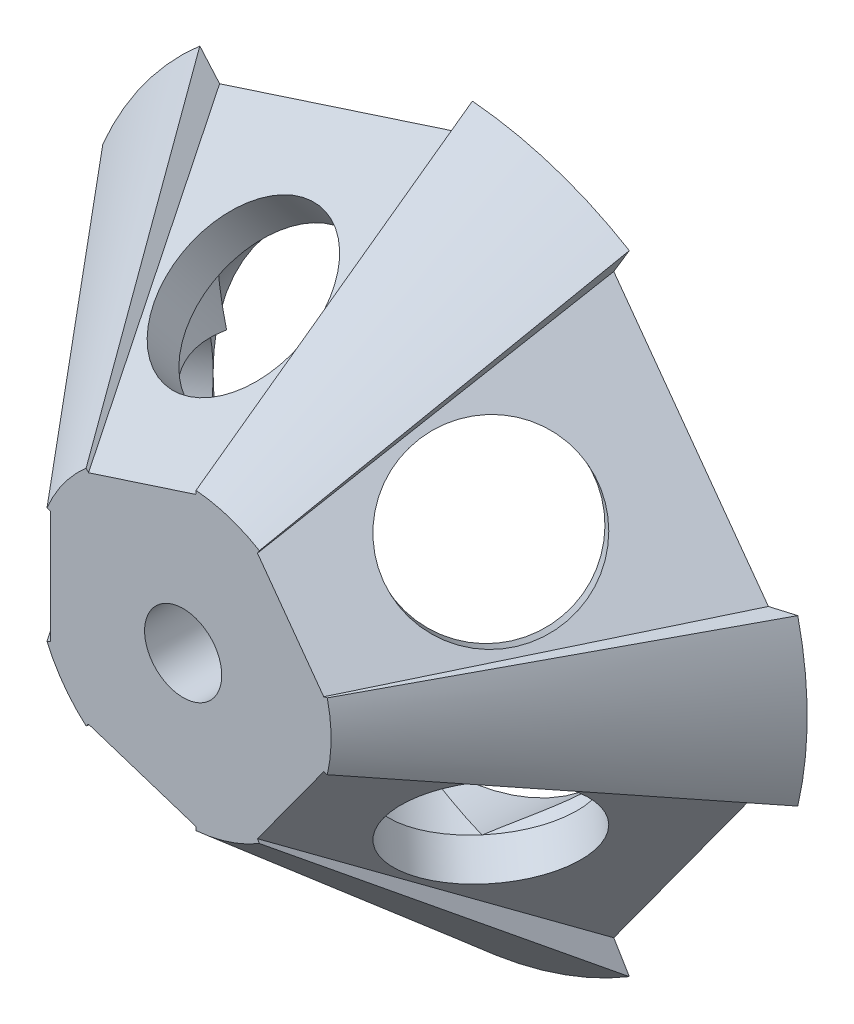
from build123d import *

# Parameters (mm, degrees)
SKETCH4_R          = 6.5
CUT_EXTRUDE1_DEPTH = 30
SKETCH5_R          = 5
CUT_EXTRUDE2_DEPTH = 12
SKETCH10_R         = 17.67367617
CUT_EXTRUDE4_DEPTH = 5
CIRPATTERN1_COUNT  = 5
CIRPATTERN2_COUNT  = 5
SKETCH7_R          = 3
CUT_EXTRUDE3_DEPTH = 20
REVOLVE1_ANGLE     = 26
CIRPATTERN3_COUNT  = 5


with BuildPart() as part:
    # Sketch2 → Loft1 section 0
    with BuildSketch(Plane.XY):
        with BuildLine():
            Line((9.200294462, -28.315594803), (29.772778292, 0))
            Line((29.772778292, 0), (9.200294462, 28.315594803))
            Line((9.200294462, 28.315594803), (-24.086683608, 17.5))
            Line((-24.086683608, 17.5), (-24.086683608, -17.5))
            Line((-24.086683608, -17.5), (9.200294462, -28.315594803))
        make_face()
    # Sketch3 → Loft1 section 1
    with BuildSketch(Plane.XY.offset(20)):
        with BuildLine():
            Line((-10.322864404, 7.5), (-10.322864404, -7.5))
            Line((-10.322864404, -7.5), (3.942983341, -12.135254916))
            Line((3.942983341, -12.135254916), (12.759762125, 0))
            Line((12.759762125, 0), (3.942983341, 12.135254916))
            Line((3.942983341, 12.135254916), (-10.322864404, 7.5))
        make_face()
    loft()

    # Sketch4 → Cut-Extrude1 (cut)
    with BuildSketch(Plane(origin=(-16.345393931, 0, 11.248752345), x_dir=(0.5669152706817989, 0, 0.8237761078519957), z_dir=(-0.8237761078519957, 0, 0.5669152706817989))):
        with Locations((-1.515888034, 0)):
            Circle(SKETCH4_R)
    cut_extrude1 = extrude(amount=-CUT_EXTRUDE1_DEPTH, mode=Mode.SUBTRACT)

    # Sketch5 → Cut-Extrude2 (cut)
    with BuildSketch(Plane(origin=(0, 0, 0), x_dir=(-1, 0, 0), z_dir=(0, 0, -1))):
        Circle(SKETCH5_R)
    extrude(amount=-CUT_EXTRUDE2_DEPTH, mode=Mode.SUBTRACT)

    # Sketch10 → Cut-Extrude4 (cut)
    with BuildSketch(Plane(origin=(0, 0, 0), x_dir=(-1, 0, 0), z_dir=(0, 0, -1))):
        Circle(SKETCH10_R)
    extrude(amount=-CUT_EXTRUDE4_DEPTH, mode=Mode.SUBTRACT)

    # CirPattern1: Cut-Extrude1 ×5 about axis
    cirpattern1_axis = Axis((0, 0, 31.50011), (0, 0, -1))
    for i in range(1, CIRPATTERN1_COUNT):
        add(cut_extrude1.rotate(cirpattern1_axis, i * 360 / CIRPATTERN1_COUNT), mode=Mode.SUBTRACT)

    # Sketch6 → Cut-Revolve1 (revolve, cut)
    with BuildSketch(Plane(origin=(0, 0, 0), x_dir=(1, 0, 0), z_dir=(0, 1, 0))):
        Polygon((0.195413013, -8.343686202), (-9.914665882, -15.301351105), (-11.583276534, -12.876717902), (-4.896377935, -8.274854734), align=None)
    cut_revolve1 = revolve(axis=Axis((-2.750814317, 0, 0.052915603), (-0.8237761078519957, 0, 0.5669152706817989)), mode=Mode.SUBTRACT)

    # CirPattern2: Cut-Revolve1 ×5 about axis
    cirpattern2_axis = Axis((0, 0, 0), (0, 0, 1))
    for i in range(1, CIRPATTERN2_COUNT):
        add(cut_revolve1.rotate(cirpattern2_axis, i * 360 / CIRPATTERN2_COUNT), mode=Mode.SUBTRACT)

    # Sketch7 → Cut-Extrude3 (cut)
    with BuildSketch(Plane.XY.offset(20)):
        Circle(SKETCH7_R)
    extrude(amount=-CUT_EXTRUDE3_DEPTH, mode=Mode.SUBTRACT)

    # Sketch9 → Cut-Revolve2 (revolve, cut)
    with BuildSketch(Plane(origin=(0, 0, 0), x_dir=(1, 0, 0), z_dir=(0, 1, 0)), mode=Mode.PRIVATE) as cut_revolve2_sk:
        Polygon((28.513016167, 0), (11.5, -20), (21.502902944, -41.274108002), (58.575955943, -6.2990668), (42.004791136, 5.10668776), align=None)
    revolve(cut_revolve2_sk.sketch.rotate(Axis((0, 0, 31.50011), (0, 0, -1)), 180), axis=Axis((0, 0, 31.50011), (0, 0, -1)), mode=Mode.SUBTRACT)

    # Sketch11 → Revolve1 (revolve, symmetric)
    with BuildSketch(Plane(origin=(0, 0, 0), x_dir=(1, 0, 0), z_dir=(0, 1, 0))) as revolve1_sk:
        Polygon((11.5, -20), (28.513016167, 0), (25.034878944, 0), (8.021862777, -20), align=None)
    revolve1 = revolve(axis=Axis((0, 0, 0), (0, 0, 1)), revolution_arc=REVOLVE1_ANGLE / 2)
    revolve1 = revolve1 + revolve(revolve1_sk.sketch, axis=Axis((0, 0, 0), (0, 0, -1)), revolution_arc=REVOLVE1_ANGLE / 2)

    # CirPattern3: Revolve1 ×5 about axis
    cirpattern3_axis = Axis((0, 0, 0), (0, 0, 1))
    for i in range(1, CIRPATTERN3_COUNT):
        add(revolve1.rotate(cirpattern3_axis, i * 360 / CIRPATTERN3_COUNT))


solid = part.part
